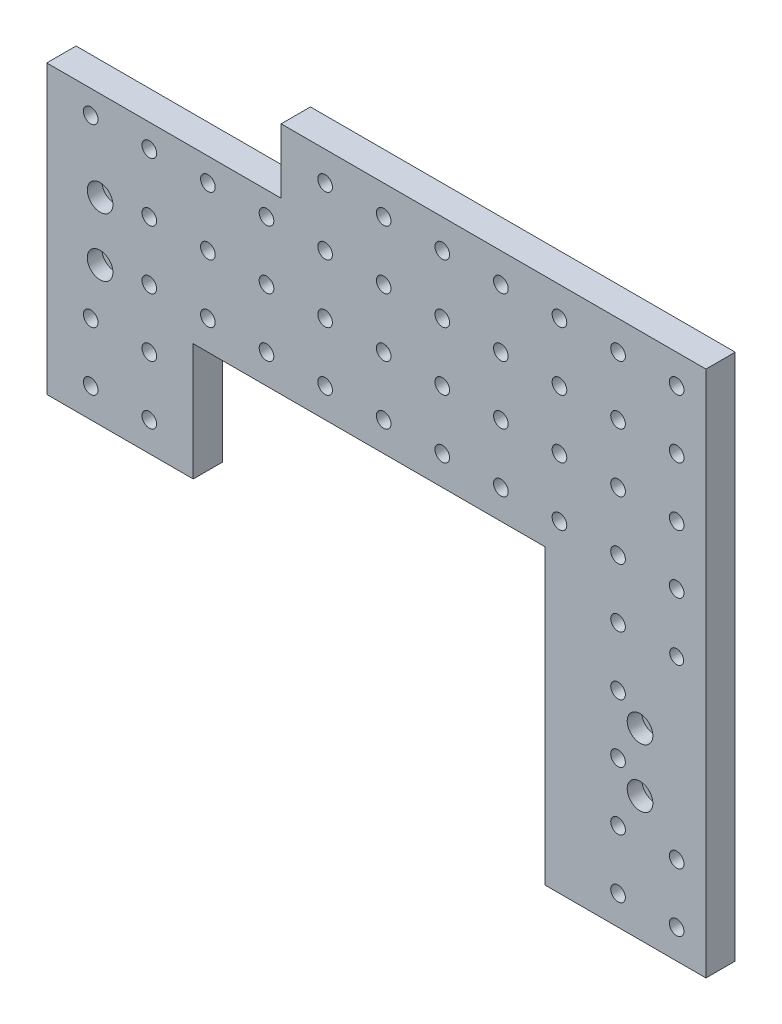
from build123d import *

# Parameters (mm, degrees)
SKETCH1_R           = 3.175
SKETCH1_R_2         = 3.001746658
BOSS_EXTRUDE1_DEPTH = 12.7
SKETCH6_R           = 3.3734375
CUT_EXTRUDE6_DEPTH  = 12.7
SKETCH6_3_R         = 5.55625
SKETCH6_3_R_2       = 3.3734375
CUT_EXTRUDE7_DEPTH  = 6.35
CUT_EXTRUDE8_DEPTH  = 6.35
SKETCH7_W           = 101.6
SKETCH7_H           = 27.94
CUT_EXTRUDE9_DEPTH  = 12.7
SKETCH8_R           = 3.3734375
CUT_EXTRUDE10_DEPTH = 12.7
SKETCH8_3_R         = 5.55625
SKETCH8_3_R_2       = 3.3734375
CUT_EXTRUDE11_DEPTH = 6.35


with BuildPart() as part:
    # Sketch1 → Boss-Extrude1 (new body)
    with BuildSketch(Plane.XY):
        Polygon((0, 152.4), (0, 0), (63.5, 0), (63.5, 50.8), (215.9, 50.8), (215.9, -76.2), (285.75, -76.2), (285.75, 152.4), align=None)
        with Locations((19.05, 12.7)):
            Circle(SKETCH1_R, mode=Mode.SUBTRACT)
        with Locations((19.05, 38.1)):
            Circle(SKETCH1_R, mode=Mode.SUBTRACT)
        with Locations((44.45, 12.7)):
            Circle(SKETCH1_R, mode=Mode.SUBTRACT)
        with Locations((44.45, 38.1)):
            Circle(SKETCH1_R, mode=Mode.SUBTRACT)
        with Locations((247.65, -63.5)):
            Circle(SKETCH1_R, mode=Mode.SUBTRACT)
        with Locations((273.05, -63.5)):
            Circle(SKETCH1_R, mode=Mode.SUBTRACT)
        with Locations((247.65, -38.1)):
            Circle(SKETCH1_R, mode=Mode.SUBTRACT)
        with Locations((273.05, -38.1)):
            Circle(SKETCH1_R, mode=Mode.SUBTRACT)
        with Locations((247.65, -12.7)):
            Circle(SKETCH1_R, mode=Mode.SUBTRACT)
        with Locations((247.65, 12.7)):
            Circle(SKETCH1_R, mode=Mode.SUBTRACT)
        with Locations((247.65, 38.1)):
            Circle(SKETCH1_R, mode=Mode.SUBTRACT)
        with Locations((44.45, 63.5)):
            Circle(SKETCH1_R, mode=Mode.SUBTRACT)
        with Locations((69.85, 63.5)):
            Circle(SKETCH1_R, mode=Mode.SUBTRACT)
        with Locations((44.45, 88.9)):
            Circle(SKETCH1_R, mode=Mode.SUBTRACT)
        with Locations((69.85, 88.9)):
            Circle(SKETCH1_R, mode=Mode.SUBTRACT)
        with Locations((95.25, 63.5)):
            Circle(SKETCH1_R, mode=Mode.SUBTRACT)
        with Locations((120.65, 63.5)):
            Circle(SKETCH1_R, mode=Mode.SUBTRACT)
        with Locations((95.25, 88.9)):
            Circle(SKETCH1_R, mode=Mode.SUBTRACT)
        with Locations((120.65, 88.9)):
            Circle(SKETCH1_R, mode=Mode.SUBTRACT)
        with Locations((19.05, 114.3)):
            Circle(SKETCH1_R, mode=Mode.SUBTRACT)
        with Locations((44.45, 114.3)):
            Circle(SKETCH1_R, mode=Mode.SUBTRACT)
        with Locations((69.85, 114.3)):
            Circle(SKETCH1_R, mode=Mode.SUBTRACT)
        with Locations((19.05, 139.7)):
            Circle(SKETCH1_R, mode=Mode.SUBTRACT)
        with Locations((44.45, 139.7)):
            Circle(SKETCH1_R, mode=Mode.SUBTRACT)
        with Locations((69.85, 139.7)):
            Circle(SKETCH1_R, mode=Mode.SUBTRACT)
        with Locations((95.25, 114.3)):
            Circle(SKETCH1_R, mode=Mode.SUBTRACT)
        with Locations((120.65, 114.3)):
            Circle(SKETCH1_R, mode=Mode.SUBTRACT)
        with Locations((95.25, 139.7)):
            Circle(SKETCH1_R, mode=Mode.SUBTRACT)
        with Locations((120.65, 139.7)):
            Circle(SKETCH1_R, mode=Mode.SUBTRACT)
        with Locations((146.05, 63.5)):
            Circle(SKETCH1_R, mode=Mode.SUBTRACT)
        with Locations((171.45, 63.5)):
            Circle(SKETCH1_R, mode=Mode.SUBTRACT)
        with Locations((196.85, 63.5)):
            Circle(SKETCH1_R, mode=Mode.SUBTRACT)
        with Locations((146.05, 88.9)):
            Circle(SKETCH1_R, mode=Mode.SUBTRACT)
        with Locations((171.45, 88.9)):
            Circle(SKETCH1_R, mode=Mode.SUBTRACT)
        with Locations((196.85, 88.9)):
            Circle(SKETCH1_R, mode=Mode.SUBTRACT)
        with Locations((222.25, 63.5)):
            Circle(SKETCH1_R, mode=Mode.SUBTRACT)
        with Locations((247.65, 63.5)):
            Circle(SKETCH1_R, mode=Mode.SUBTRACT)
        with Locations((273.05, 63.5)):
            Circle(SKETCH1_R, mode=Mode.SUBTRACT)
        with Locations((222.25, 88.9)):
            Circle(SKETCH1_R, mode=Mode.SUBTRACT)
        with Locations((247.65, 88.9)):
            Circle(SKETCH1_R, mode=Mode.SUBTRACT)
        with Locations((273.05, 88.9)):
            Circle(SKETCH1_R, mode=Mode.SUBTRACT)
        with Locations((146.05, 114.3)):
            Circle(SKETCH1_R, mode=Mode.SUBTRACT)
        with Locations((171.45, 114.3)):
            Circle(SKETCH1_R, mode=Mode.SUBTRACT)
        with Locations((196.85, 114.3)):
            Circle(SKETCH1_R, mode=Mode.SUBTRACT)
        with Locations((146.05, 139.7)):
            Circle(SKETCH1_R, mode=Mode.SUBTRACT)
        with Locations((171.45, 139.7)):
            Circle(SKETCH1_R, mode=Mode.SUBTRACT)
        with Locations((196.85, 139.7)):
            Circle(SKETCH1_R, mode=Mode.SUBTRACT)
        with Locations((222.25, 114.3)):
            Circle(SKETCH1_R, mode=Mode.SUBTRACT)
        with Locations((247.65, 114.3)):
            Circle(SKETCH1_R, mode=Mode.SUBTRACT)
        with Locations((273.05, 114.3)):
            Circle(SKETCH1_R, mode=Mode.SUBTRACT)
        with Locations((222.25, 139.7)):
            Circle(SKETCH1_R, mode=Mode.SUBTRACT)
        with Locations((247.65, 139.7)):
            Circle(SKETCH1_R, mode=Mode.SUBTRACT)
        with Locations((273.05, 139.7)):
            Circle(SKETCH1_R, mode=Mode.SUBTRACT)
        with Locations((273.05, 38.1)):
            Circle(SKETCH1_R_2, mode=Mode.SUBTRACT)
    extrude(amount=BOSS_EXTRUDE1_DEPTH)

    # Sketch6 → Cut-Extrude6 (cut)
    with BuildSketch(Plane.XY.offset(12.7)):
        with Locations((23.114, 60.1472)):
            Circle(SKETCH6_R)
        with Locations((23.114, 85.5472)):
            Circle(SKETCH6_R)
    extrude(amount=-CUT_EXTRUDE6_DEPTH, mode=Mode.SUBTRACT)

    # Sketch6<3> → Cut-Extrude7 (cut)
    # profile 1 of 2: a face of its own
    with BuildSketch(Plane.XY.offset(12.7)):
        with Locations((23.114, 85.5472)):
            Circle(SKETCH6_3_R)
        with Locations((23.114, 85.5472)):
            Circle(SKETCH6_3_R_2, mode=Mode.SUBTRACT)
    # profile 2 of 2: a face of its own
    with BuildSketch(Plane.XY.offset(12.7)):
        with BuildLine():
            Line((23.114, 56.7737625), (23.114, 54.59095))
            ThreePointArc((23.114, 54.59095), (27.042862053, 56.218337947), (28.67025, 60.1472))
            ThreePointArc((28.67025, 60.1472), (23.114, 65.70345), (17.55775, 60.1472))
            Line((17.55775, 60.1472), (19.7405625, 60.1472))
            ThreePointArc((19.7405625, 60.1472), (23.114, 63.5206375), (26.4874375, 60.1472))
            ThreePointArc((26.4874375, 60.1472), (25.499380532, 57.761819468), (23.114, 56.7737625))
        make_face()
    extrude(amount=-CUT_EXTRUDE7_DEPTH, mode=Mode.SUBTRACT)

    # Sketch6<4> → Cut-Extrude8 (cut)
    with BuildSketch(Plane.XY.offset(12.7)):
        with BuildLine():
            ThreePointArc((17.55775, 60.1472), (19.185137947, 56.218337947), (23.114, 54.59095))
            Line((23.114, 54.59095), (23.114, 56.7737625))
            ThreePointArc((23.114, 56.7737625), (20.728619468, 57.761819468), (19.7405625, 60.1472))
            Line((19.7405625, 60.1472), (17.55775, 60.1472))
        make_face()
        with BuildLine():
            Line((23.114, 56.7737625), (23.114, 54.59095))
            ThreePointArc((23.114, 54.59095), (27.042862053, 56.218337947), (28.67025, 60.1472))
            ThreePointArc((28.67025, 60.1472), (23.114, 65.70345), (17.55775, 60.1472))
            Line((17.55775, 60.1472), (19.7405625, 60.1472))
            ThreePointArc((19.7405625, 60.1472), (23.114, 63.5206375), (26.4874375, 60.1472))
            ThreePointArc((26.4874375, 60.1472), (25.499380532, 57.761819468), (23.114, 56.7737625))
        make_face()
    extrude(amount=-CUT_EXTRUDE8_DEPTH, mode=Mode.SUBTRACT)

    # Sketch7 → Cut-Extrude9 (cut)
    with BuildSketch(Plane.XY.offset(12.7)):
        with Locations((50.8, 138.43)):
            Rectangle(SKETCH7_W, SKETCH7_H)
    extrude(amount=-CUT_EXTRUDE9_DEPTH, mode=Mode.SUBTRACT)

    # Sketch8 → Cut-Extrude10 (cut)
    with BuildSketch(Plane.XY.offset(12.7)):
        with Locations((257.175, -22.1742)):
            Circle(SKETCH8_R)
        with Locations((257.175, 3.2258)):
            Circle(SKETCH8_R)
    extrude(amount=-CUT_EXTRUDE10_DEPTH, mode=Mode.SUBTRACT)

    # Sketch8<3> → Cut-Extrude11 (cut)
    # profile 1 of 2: a face of its own
    with BuildSketch(Plane.XY.offset(12.7)):
        with Locations((257.175, 3.2258)):
            Circle(SKETCH8_3_R)
        with Locations((257.175, 3.2258)):
            Circle(SKETCH8_3_R_2, mode=Mode.SUBTRACT)
    # profile 2 of 2: a face of its own
    with BuildSketch(Plane.XY.offset(12.7)):
        with Locations((257.175, -22.1742)):
            Circle(SKETCH8_3_R)
        with Locations((257.175, -22.1742)):
            Circle(SKETCH8_3_R_2, mode=Mode.SUBTRACT)
    extrude(amount=-CUT_EXTRUDE11_DEPTH, mode=Mode.SUBTRACT)


solid = part.part
